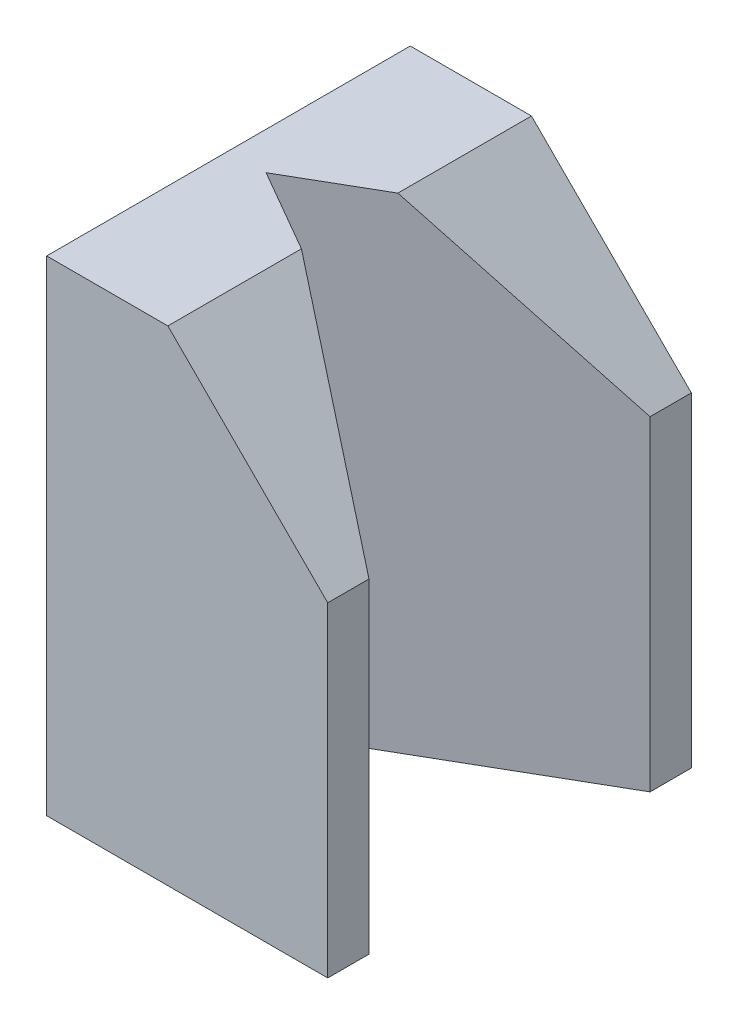
from build123d import *

# Parameters (mm, degrees)
BOSS_EXTRUDE1_DEPTH     = 76.2
CUT_EXTRUDE1_DEPTH      = 95.715964076
CUT_EXTRUDE1_DEPTH_BACK = 95.715964076


with BuildPart() as part:
    # Sketch1 → Boss-Extrude1 (new body)
    with BuildSketch(Plane(origin=(0, 0, 0), x_dir=(1, 0, 0), z_dir=(0, 1, 0))):
        Polygon((44.177534378, 22.321573291), (0, 22.321573291), (0, -34.828426709), (44.177534378, -34.828426709), (44.177534378, -28.342193898), (5.91866733, -6.253426709), (44.177534378, 15.83534048), align=None)
    extrude(amount=BOSS_EXTRUDE1_DEPTH)

    # Sketch3 → Cut-Extrude1 (cut, two sides: drawn at the far end of the back side and taken through both)
    with BuildSketch(Plane.XY.offset(-CUT_EXTRUDE1_DEPTH_BACK)):
        Polygon((-101.492059558, 196.742059558), (19.05, 76.2), (44.177534378, 51.072465622), (164.719593936, -69.469593936), (405.803713052, 171.61452518), (139.592059558, 437.826178674), align=None)
    extrude(amount=CUT_EXTRUDE1_DEPTH + CUT_EXTRUDE1_DEPTH_BACK, mode=Mode.SUBTRACT)


solid = part.part
